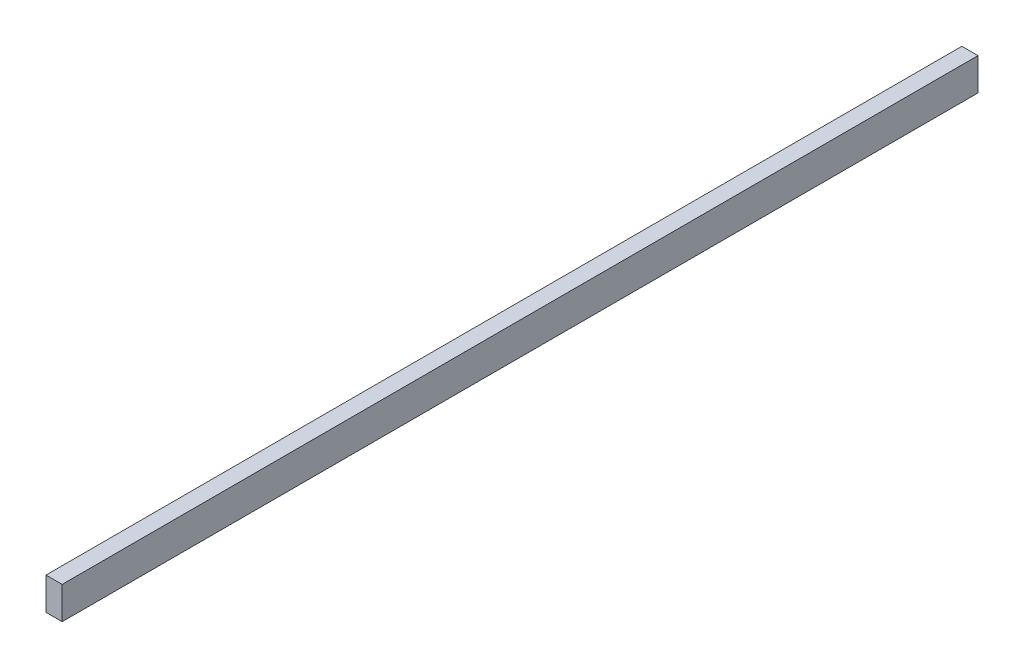
from build123d import *

# Parameters (mm, degrees)
SKETCH2_W           = 1.5
SKETCH2_H           = 85
BOSS_EXTRUDE1_DEPTH = 3


with BuildPart() as part:
    # Sketch2 → Boss-Extrude1 (new body)
    with BuildSketch(Plane(origin=(0, 0, 0), x_dir=(1, 0, 0), z_dir=(0, 1, 0))):
        Rectangle(SKETCH2_W, SKETCH2_H)
    extrude(amount=BOSS_EXTRUDE1_DEPTH)


solid = part.part
